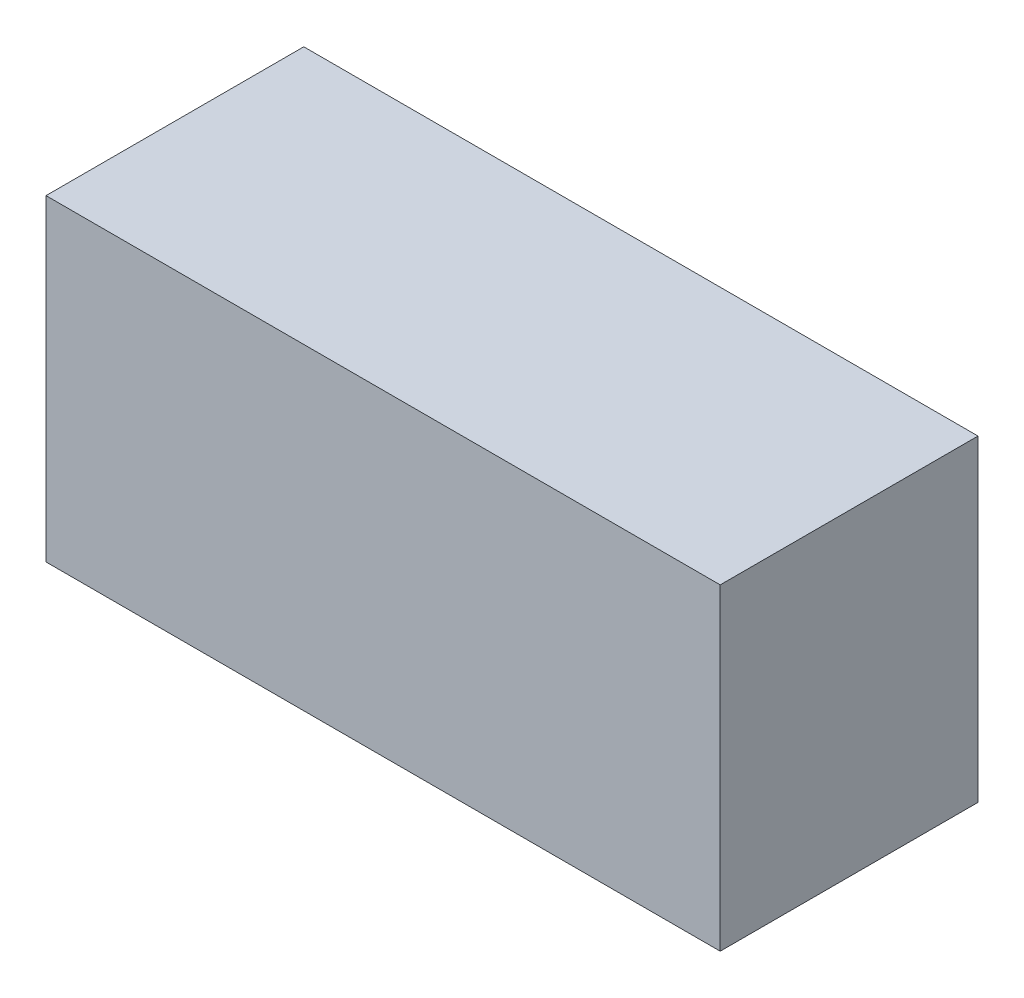
from build123d import *

# Parameters (mm, degrees)
SKETCH1_W               = 1.6999966
SKETCH1_H               = 0.7999984
COMPONENT_OUTLINE_DEPTH = 0.6500114


with BuildPart() as part:
    # Sketch1 → Component_Outline (new body)
    with BuildSketch(Plane.XY):
        with Locations((1.0250043, 0)):
            Rectangle(SKETCH1_W, SKETCH1_H)
    extrude(amount=COMPONENT_OUTLINE_DEPTH)


solid = part.part
